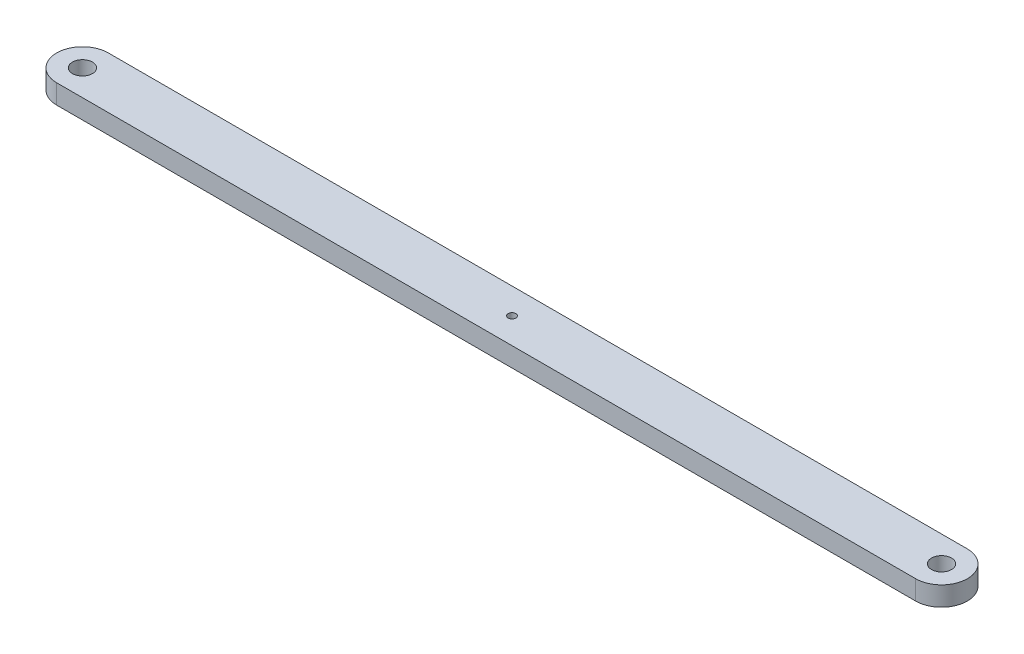
from build123d import *

# Parameters (mm, degrees)
SKETCH1_R               = 1.55
BOSS_EXTRUDE1_DEPTH     = 3
CUT_EXTRUDE2_DEPTH      = 71.677082566
CUT_EXTRUDE2_DEPTH_BACK = 71.677082566
SKETCH2_R               = 0.6


with BuildPart() as part:
    # Sketch1 → Boss-Extrude1 (new body)
    with BuildSketch(Plane(origin=(0, 0, 0), x_dir=(1, 0, 0), z_dir=(0, 1, 0))):
        with BuildLine():
            Line((-66.5, 4), (66.5, 4))
            ThreePointArc((66.5, 4), (70.5, 0), (66.5, -4))
            Line((66.5, -4), (-66.5, -4))
            ThreePointArc((-66.5, -4), (-70.5, 0), (-66.5, 4))
        make_face()
        with Locations(Location((-66.5, 0, 0), (0, 0, 270))):
            Circle(SKETCH1_R, mode=Mode.SUBTRACT)
        with Locations(Location((66.5, 0, 0), (0, 0, 90))):
            Circle(SKETCH1_R, mode=Mode.SUBTRACT)
    extrude(amount=BOSS_EXTRUDE1_DEPTH)

    # Sketch2 → Cut-Extrude2 (cut, two sides: drawn at the far end of the back side and taken through both)
    with BuildSketch(Plane(origin=(0, 0, 0), x_dir=(1, 0, 0), z_dir=(0, 1, 0)).offset(-CUT_EXTRUDE2_DEPTH_BACK)):
        with Locations(Location((0, 0, 0), (0, 0, 270))):
            Circle(SKETCH2_R)
    extrude(amount=CUT_EXTRUDE2_DEPTH + CUT_EXTRUDE2_DEPTH_BACK, mode=Mode.SUBTRACT)


solid = part.part
